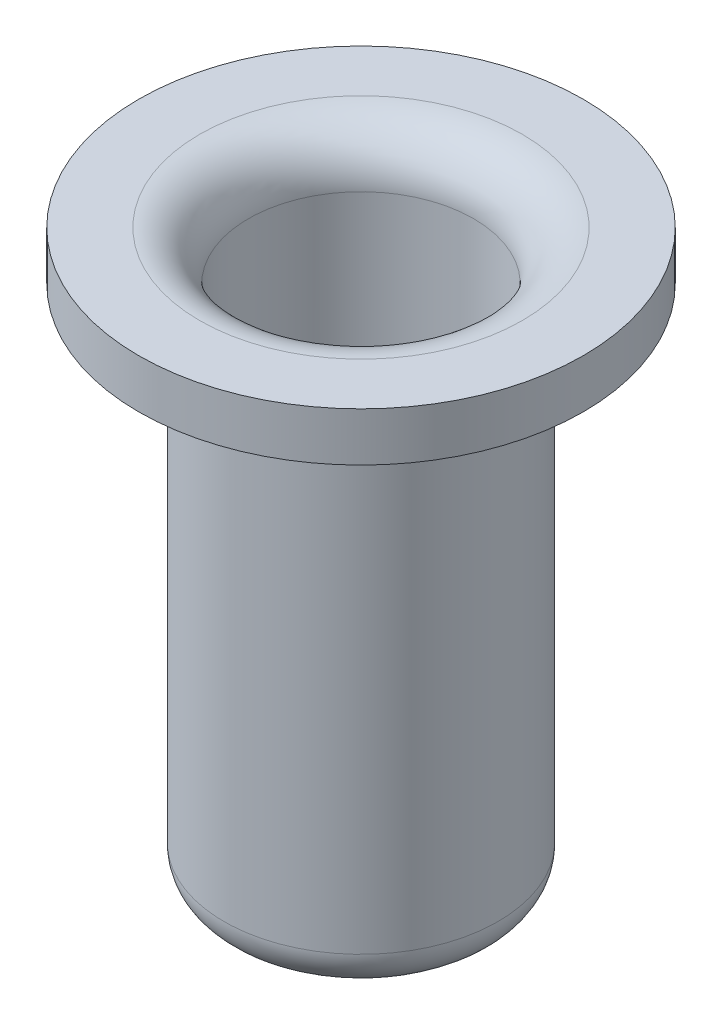
from build123d import *

# Parameters (mm, degrees)
FILLET1_R = 4
FILLET2_R = 8


with BuildPart() as part:
    # Sketch1 → Revolve1 (revolve)
    with BuildSketch(Plane.XY, mode=Mode.PRIVATE) as revolve1_sk:
        with BuildLine():
            Line((22.5, 86), (22.5, 6.5))
            ThreePointArc((22.5, 6.5), (20.596194078, 1.903805922), (16, 0))
            Line((16, 0), (0, 0))
            Line((0, 0), (0, 4))
            Line((0, 4), (16, 4))
            ThreePointArc((16, 4), (17.767766953, 4.732233047), (18.5, 6.5))
            Line((18.5, 6.5), (18.5, 94))
            Line((18.5, 94), (36.5, 94))
            Line((36.5, 94), (36.5, 86))
            Line((36.5, 86), (22.5, 86))
        make_face()
    revolve(revolve1_sk.sketch.rotate(Axis((0, 0, 0), (0, 1, 0)), 90), axis=Axis((0, 0, 0), (0, 1, 0)))

    # Fillet1
    fillet1_edges = [part.edges().sort_by_distance(p)[0] for p in [
        (0, 86, 22.5),
    ]]
    fillet(fillet1_edges, radius=FILLET1_R)

    # Fillet2
    fillet2_edges = [part.edges().sort_by_distance(p)[0] for p in [
        (0, 94, 18.5),
    ]]
    fillet(fillet2_edges, radius=FILLET2_R)


solid = part.part
